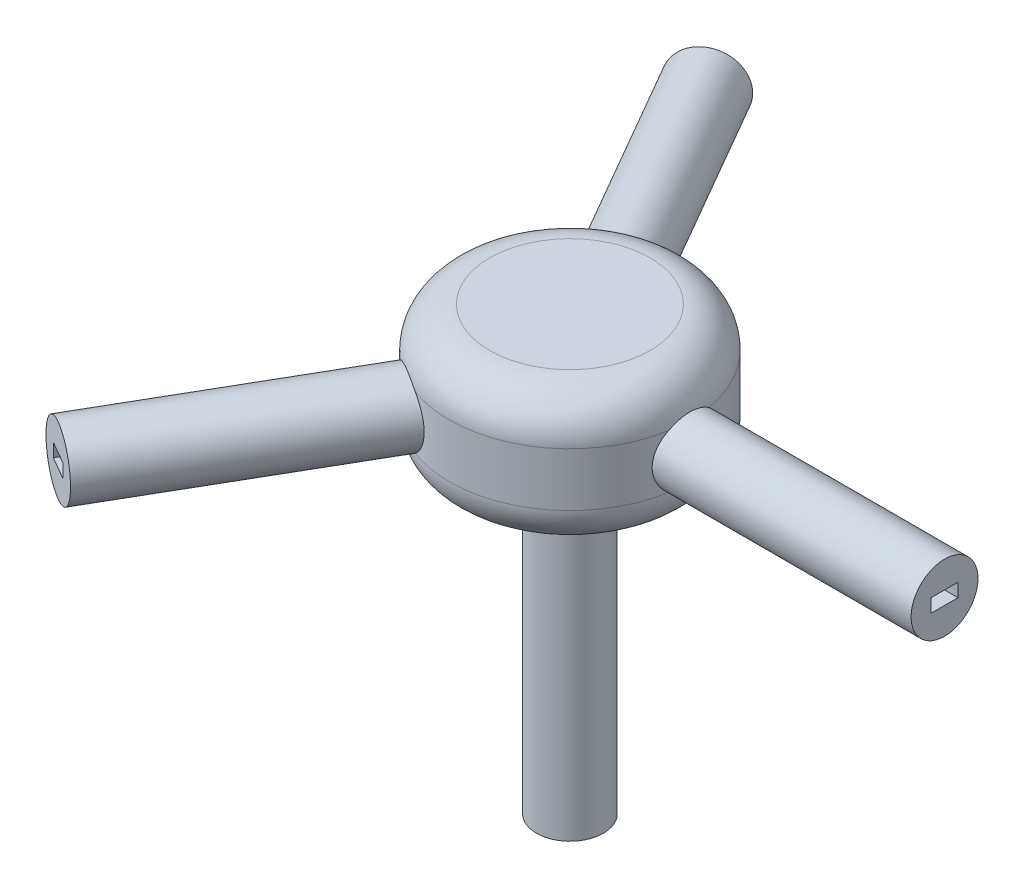
from build123d import *

# Parameters (mm, degrees)
SKETCH_1_W               = 25
SKETCH_1_H               = 230
SKETCH_5_R               = 25
EXTRUDE_1_DEPTH          = 280
PATTERN_CIRCULAR_1_COUNT = 3
SKETCH_7_W               = 20
SKETCH_7_H               = 10
CUT_EXTRUDE_2_DEPTH      = 10
PATTERN_CIRCULAR_2_COUNT = 3


with BuildPart() as part:
    # 草图1 → 旋转1 (revolve)
    with BuildSketch(Plane.XY, mode=Mode.PRIVATE) as revolve_1_sk:
        with BuildLine():
            Line((90, -20), (90, 20))
            ThreePointArc((90, 20), (81.213203436, 41.213203436), (60, 50))
            Line((60, 50), (0, 50))
            Line((0, 50), (0, -50))
            Line((0, -50), (60, -50))
            ThreePointArc((60, -50), (81.213203436, -41.213203436), (90, -20))
        make_face()
        with Locations((12.5, -165)):
            Rectangle(SKETCH_1_W, SKETCH_1_H)
    revolve(revolve_1_sk.sketch.rotate(Axis((0, 124, 0), (0, -1, 0)), 90), axis=Axis((0, 124, 0), (0, -1, 0)))

    # 草图5 → 凸台-拉伸1 (add)
    with BuildSketch(Plane(origin=(0, 0, 0), x_dir=(0, 0, -1), z_dir=(1, 0, 0))):
        with Locations(Location((0, 0, 0), (0, 0, 126.869897646))):
            Circle(SKETCH_5_R)
    extrude_1 = extrude(amount=EXTRUDE_1_DEPTH)

    # 阵列(圆周)1: 凸台-拉伸1 ×3 about axis
    pattern_circular_1_axis = Axis((0, 0, 0), (0, 1, 0))
    for i in range(1, PATTERN_CIRCULAR_1_COUNT):
        add(extrude_1.rotate(pattern_circular_1_axis, i * 360 / PATTERN_CIRCULAR_1_COUNT))

    # 草图7 → 切除-拉伸2 (cut)
    with BuildSketch(Plane(origin=(280, 0, 0), x_dir=(0, 0, -1), z_dir=(1, 0, 0))):
        Rectangle(SKETCH_7_W, SKETCH_7_H)
    cut_extrude_2 = extrude(amount=-CUT_EXTRUDE_2_DEPTH, mode=Mode.SUBTRACT)

    # 阵列(圆周)2: 切除-拉伸2 ×3 about axis
    pattern_circular_2_axis = Axis((0, 0, 0), (0, 1, 0))
    for i in range(1, PATTERN_CIRCULAR_2_COUNT):
        add(cut_extrude_2.rotate(pattern_circular_2_axis, i * 360 / PATTERN_CIRCULAR_2_COUNT), mode=Mode.SUBTRACT)


solid = part.part
